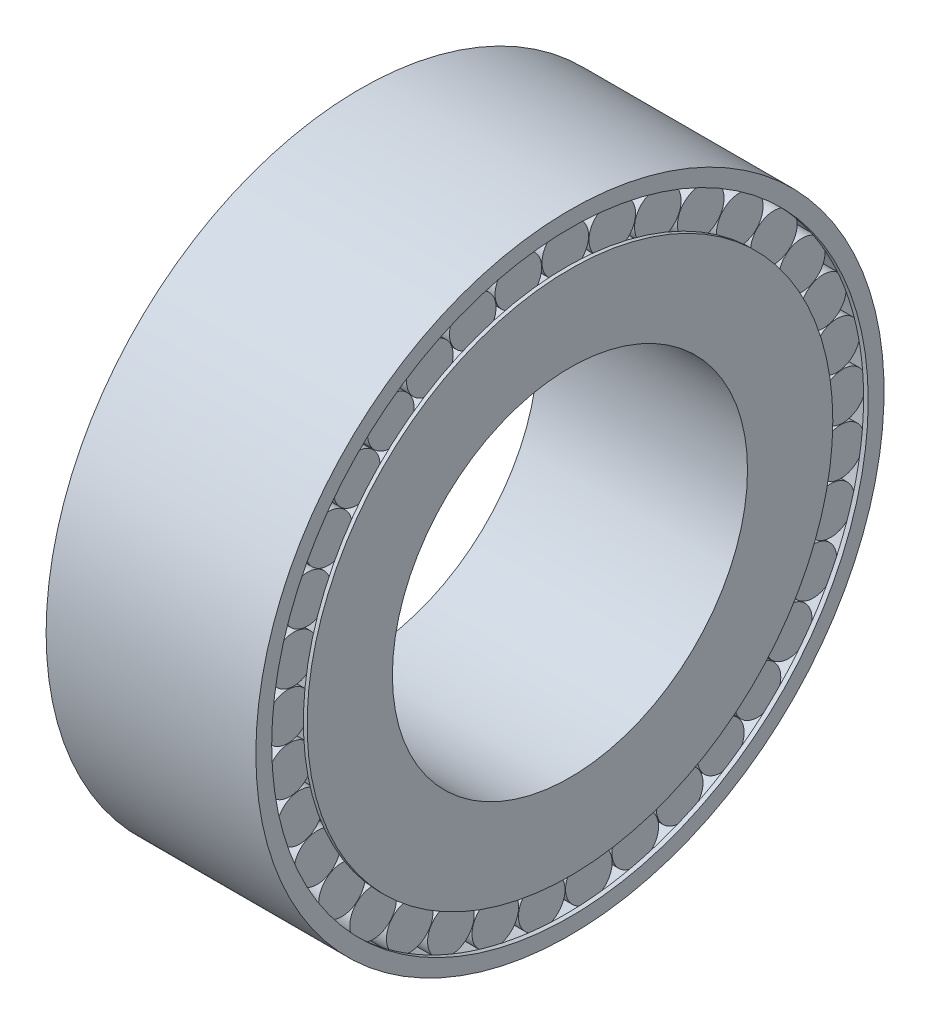
from build123d import *

# Parameters (mm, degrees)
SKETCH_3_W               = 19
SKETCH_3_H               = 5
PATTERN_CIRCULAR_1_COUNT = 37


with BuildPart() as part:
    # 草图1 → 旋转1 (revolve)
    with BuildSketch(Plane.XY, mode=Mode.PRIVATE) as revolve_1_sk:
        Polygon((0, 67.4), (45, 67.4), (45, 64), (44, 64), (44, 64.7), (1, 64.7), (1, 64), (0, 64), align=None)
    revolve(revolve_1_sk.sketch.rotate(Axis((0, 0, 0), (1, 0, 0)), 90), axis=Axis((0, 0, 0), (1, 0, 0)))

    # 草图3 → 旋转3 (revolve)
    with BuildSketch(Plane.XY):
        with Locations((10.5, 62.1)):
            Rectangle(SKETCH_3_W, SKETCH_3_H)
        with Locations((34.5, 62.1)):
            Rectangle(SKETCH_3_W, SKETCH_3_H)
    revolve_3 = revolve(axis=Axis((44, 59.6, 0), (-1, 0, 0)))

    # 阵列(圆周)1: 旋转3 ×37 about axis
    pattern_circular_1_axis = Axis((0, 0, 0), (1, 0, 0))
    for i in range(1, PATTERN_CIRCULAR_1_COUNT):
        add(revolve_3.rotate(pattern_circular_1_axis, i * 360 / PATTERN_CIRCULAR_1_COUNT))


with BuildPart() as body_2:
    # 草图5 → 旋转6 (revolve)
    with BuildSketch(Plane.XY, mode=Mode.PRIVATE) as revolve_6_sk:
        Polygon((0, 38.1), (45, 38.1), (45, 56.4), (44.2, 56.4), (44.2, 54.4), (24.8, 54.4), (24.8, 55.9), (20.2, 55.9), (20.2, 54.4), (0.8, 54.4), (0.8, 56.4), (0, 56.4), align=None)
    revolve(revolve_6_sk.sketch.rotate(Axis((0, 0, 0), (-1, 0, 0)), 90), axis=Axis((0, 0, 0), (-1, 0, 0)))


solid = Compound([part.part, body_2.part])
